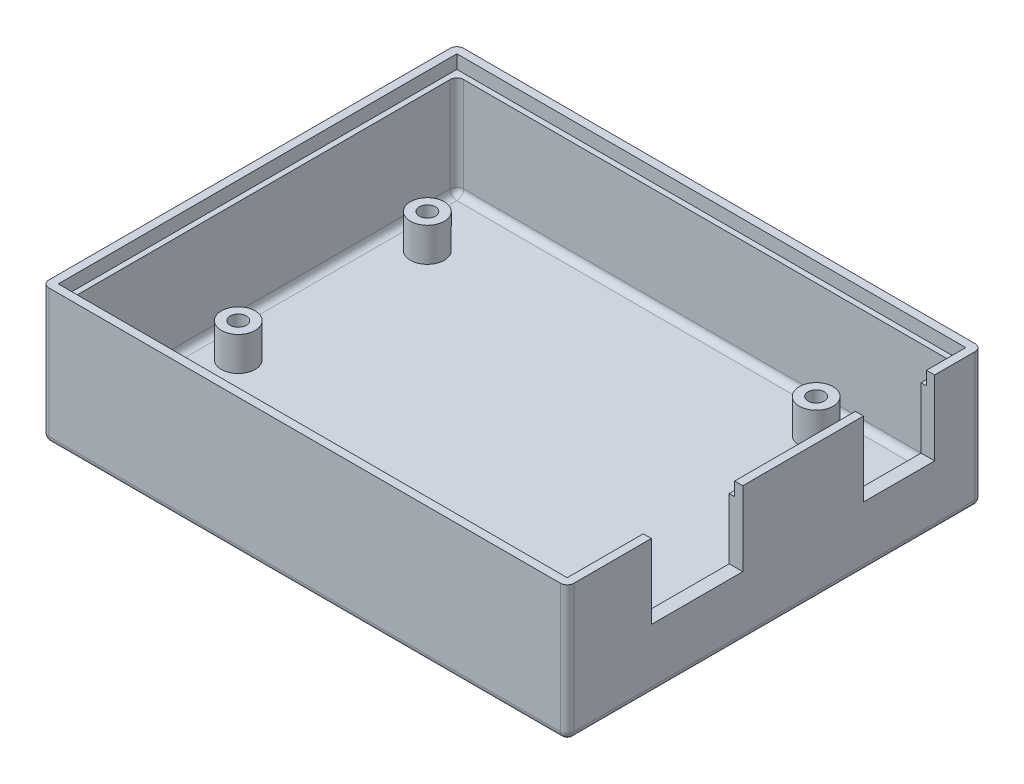
from build123d import *

# Parameters (mm, degrees)
SKETCH1_R                                       = 2.5
BOSS_EXTRUDE1_DEPTH                             = 5
BOSS_EXTRUDE1_2_DEPTH                           = 5
BOSS_EXTRUDE1_3_DEPTH                           = 5
BOSS_EXTRUDE1_4_DEPTH                           = 5
SKETCH3_W                                       = 77.6
SKETCH3_H                                       = 61.3
BOSS_EXTRUDE2_DEPTH                             = 3
SKETCH4_W                                       = 77.6
SKETCH4_H                                       = 61.3
SKETCH4_W_2                                     = 73.6
SKETCH4_H_2                                     = 57.3
BOSS_EXTRUDE3_DEPTH                             = 17
CUT_EXTRUDE2_REACH                              = 86.292
SKETCH5_W                                       = 13.5
SKETCH5_H                                       = 11
SKETCH5_W_2                                     = 10.5
FILLET1_R                                       = 1
FILLET2_R                                       = 1
SKETCH7_W                                       = 75.2
SKETCH7_H                                       = 58.9
CUT_EXTRUDE3_DEPTH                              = 2
SKETCH2_R                                       = 1
CUT_EXTRUDE1_DEPTH                              = 52.647482998
CSK_FOR_M2_FLAT_HEAD_MACHINE_SCREW1_D           = 2.4
CSK_FOR_M2_FLAT_HEAD_MACHINE_SCREW1_CSINK_D     = 4.4
CSK_FOR_M2_FLAT_HEAD_MACHINE_SCREW1_CSINK_ANGLE = 90


with BuildPart() as part:
    # Sketch1 → Boss-Extrude1 (new body)
    with BuildSketch(Plane(origin=(0, 0, 0), x_dir=(1, 0, 0), z_dir=(0, 1, 0))):
        with Locations(Location((-32.6, 19.09, 0), (0, 0, 270))):
            Circle(SKETCH1_R)
    extrude(amount=-BOSS_EXTRUDE1_DEPTH)



with BuildPart() as body_2:
    # Sketch1 → Boss-Extrude1 2 (new body)
    with BuildSketch(Plane(origin=(0, 0, 0), x_dir=(1, 0, 0), z_dir=(0, 1, 0))):
        with Locations(Location((-32.6, -8.85, 0), (0, 0, 270))):
            Circle(SKETCH1_R)
    extrude(amount=-BOSS_EXTRUDE1_2_DEPTH)


with BuildPart() as body_3:
    # Sketch1 → Boss-Extrude1 3 (new body)
    with BuildSketch(Plane(origin=(0, 0, 0), x_dir=(1, 0, 0), z_dir=(0, 1, 0))):
        with Locations(Location((19.8, 24.15, 0), (0, 0, 270))):
            Circle(SKETCH1_R)
    extrude(amount=-BOSS_EXTRUDE1_3_DEPTH)


with BuildPart() as body_4:
    # Sketch1 → Boss-Extrude1 4 (new body)
    with BuildSketch(Plane(origin=(0, 0, 0), x_dir=(1, 0, 0), z_dir=(0, 1, 0))):
        with Locations(Location((18.5, -24.05, 0), (0, 0, 270))):
            Circle(SKETCH1_R)
    extrude(amount=-BOSS_EXTRUDE1_4_DEPTH)


with BuildPart() as part_1:
    add(part.part)

    add(body_2.part)  # Boss-Extrude2 merges body 2

    add(body_3.part)  # Boss-Extrude2 merges body 3

    add(body_4.part)  # Boss-Extrude2 merges body 4
    # Sketch3 → Boss-Extrude2 (add)
    with BuildSketch(Plane.XZ.offset(5)):
        with Locations((-1, 0)):
            Rectangle(SKETCH3_W, SKETCH3_H)
    extrude(amount=BOSS_EXTRUDE2_DEPTH)

    # Sketch4 → Boss-Extrude3 (add)
    with BuildSketch(Plane(origin=(0, -5, 0), x_dir=(1, 0, 0), z_dir=(0, 1, 0))):
        with Locations((-1, 0)):
            Rectangle(SKETCH4_W, SKETCH4_H)
        with Locations((-1, 0)):
            Rectangle(SKETCH4_W_2, SKETCH4_H_2, mode=Mode.SUBTRACT)
    extrude(amount=BOSS_EXTRUDE3_DEPTH)

    # Sketch5 → Cut-Extrude2 (cut, up to next)
    with BuildSketch(Plane(origin=(37.8, 0, 0), x_dir=(0, 0, -1), z_dir=(1, 0, 0)), mode=Mode.PRIVATE) as cut_extrude2_sk1:
        with Locations((-11.45, 6.5)):
            Rectangle(SKETCH5_W, SKETCH5_H)
    cut_extrude2_tool1 = extrude(cut_extrude2_sk1.sketch, amount=-CUT_EXTRUDE2_REACH, mode=Mode.PRIVATE) & part_1.part
    # Sketch5 → Cut-Extrude2 (cut, up to next)
    with BuildSketch(Plane(origin=(37.8, 0, 0), x_dir=(0, 0, -1), z_dir=(1, 0, 0)), mode=Mode.PRIVATE) as cut_extrude2_sk2:
        with Locations((18.4, 6.5)):
            Rectangle(SKETCH5_W_2, SKETCH5_H)
    cut_extrude2_tool2 = extrude(cut_extrude2_sk2.sketch, amount=-CUT_EXTRUDE2_REACH, mode=Mode.PRIVATE) & part_1.part
    add(cut_extrude2_tool1.solids().sort_by_distance((37.8, 6.5, 11.45))[0], mode=Mode.SUBTRACT)
    add(cut_extrude2_tool2.solids().sort_by_distance((37.8, 6.5, -18.4))[0], mode=Mode.SUBTRACT)

    # Fillet1
    fillet1_edges = [part_1.edges().sort_by_distance(p)[0] for p in [
        (-1, -5, 28.65),
        (-1, -5, -28.65),
        (-37.8, -5, 0),
        (35.8, 3.5, -28.65),
        (-37.8, 3.5, -28.65),
        (-37.8, 3.5, 28.65),
        (35.8, 3.5, 28.65),
        (37.8, -8, 0),
    ]]
    fillet(fillet1_edges, radius=FILLET1_R)

    # Fillet2
    fillet2_edges = [part_1.edges().sort_by_distance(p)[0] for p in [
        (-39.8, 2, 30.65),
        (-39.8, 2, -30.65),
        (-39.8, -8, 0),
        (-1.5, -8, -30.65),
        (-1.5, -8, 30.65),
        (37.8, 2.5, 30.65),
        (37.507106781, -7.707106781, 30.65),
        (37.8, 2.5, -30.65),
        (37.507106781, -7.707106781, -30.65),
    ]]
    fillet(fillet2_edges, radius=FILLET2_R)

    # Sketch7 → Cut-Extrude3 (cut)
    with BuildSketch(Plane(origin=(0, 12, 0), x_dir=(1, 0, 0), z_dir=(0, 1, 0))):
        with Locations((-1, 0)):
            Rectangle(SKETCH7_W, SKETCH7_H)
    extrude(amount=-CUT_EXTRUDE3_DEPTH, mode=Mode.SUBTRACT)

    # Sketch2 → Cut-Extrude1 (cut, through all)
    with BuildSketch(Plane(origin=(0, 0, 0), x_dir=(1, 0, 0), z_dir=(0, 1, 0))):
        with Locations(Location((-32.6, -8.85, 0), (0, 0, 270))):
            Circle(SKETCH2_R)
        with Locations(Location((-32.6, 19.09, 0), (0, 0, 270))):
            Circle(SKETCH2_R)
        with Locations(Location((19.8, 24.15, 0), (0, 0, 270))):
            Circle(SKETCH2_R)
        with Locations(Location((18.5, -24.05, 0), (0, 0, 270))):
            Circle(SKETCH2_R)
    extrude(amount=-CUT_EXTRUDE1_DEPTH, mode=Mode.SUBTRACT)

    # CSK for M2 Flat Head Machine Screw1 (through all)
    with Locations(Plane(origin=(0, -8, 0), x_dir=(-1, 0, 0), z_dir=(0, -1, 0))):
        with Locations((32.6, 19.09), (32.6, -8.85), (-18.5, -24.05), (-19.8, 24.15)):
            CounterSinkHole(CSK_FOR_M2_FLAT_HEAD_MACHINE_SCREW1_D / 2, CSK_FOR_M2_FLAT_HEAD_MACHINE_SCREW1_CSINK_D / 2, counter_sink_angle=CSK_FOR_M2_FLAT_HEAD_MACHINE_SCREW1_CSINK_ANGLE)


solid = part_1.part
